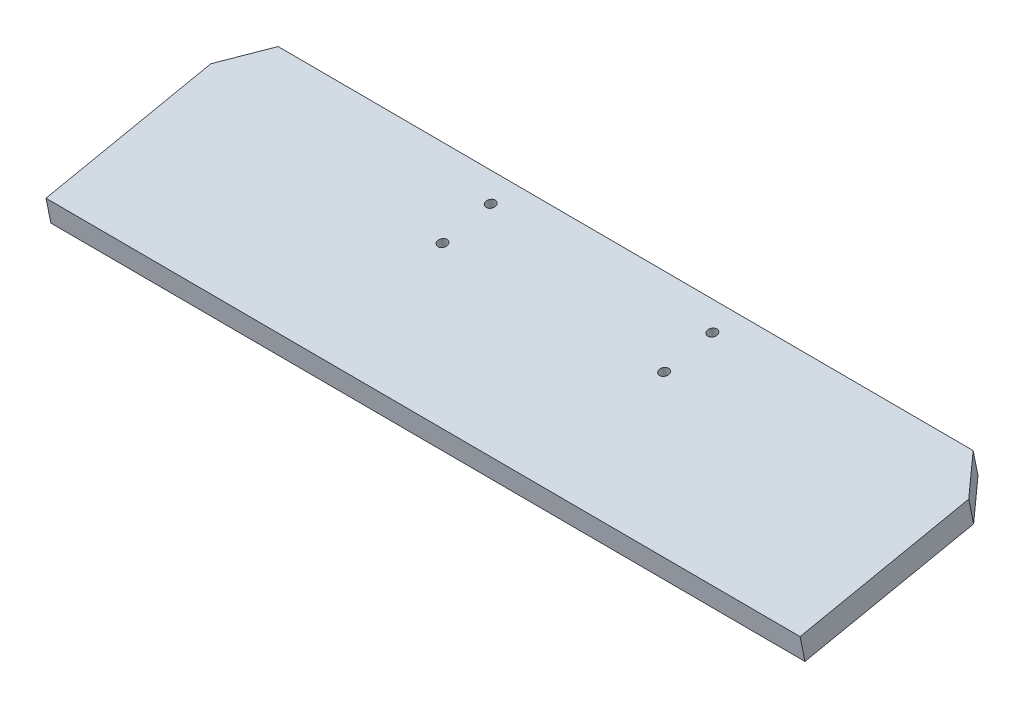
from build123d import *

# Parameters (mm, degrees)
BOSS_EXTRUDE1_DEPTH = 6.35
SKETCH4_R           = 1.190625
CUT_EXTRUDE2_DEPTH  = 398.434844364


with BuildPart() as part:
    # Sketch2 → Boss-Extrude1 (new body)
    with BuildSketch(Plane(origin=(0.683346332, 150.385179261, 31.029771586), x_dir=(-0.9999900978792948, 0.004358374370466655, 0.0008992864979534574), z_dir=(0.004450184643196504, 0.979359636230067, 0.20207646765507412))):
        Polygon((-88.422343932, 329.663853712), (90.808907549, 329.663853712), (97.754590844, 340.296232729), (97.754590844, 383.735739743), (-96.711451797, 383.735739743), (-96.711451797, 339.285739743), align=None)
    extrude(amount=BOSS_EXTRUDE1_DEPTH)

    # Sketch4 → Cut-Extrude2 (cut, through all)
    with BuildSketch(Plane(origin=(0.711605005, 156.604112951, 32.312957155), x_dir=(0.9999900978792948, -0.0043583743704666555, -0.0008992864979534572), z_dir=(0.004450184643196505, 0.9793596362300672, 0.2020764676550741))):
        with Locations((27.381718191, -336.013853712)):
            Circle(SKETCH4_R)
        with Locations((27.381718191, -348.713853712)):
            Circle(SKETCH4_R)
        with Locations((-29.768281809, -348.713853712)):
            Circle(SKETCH4_R)
        with Locations((-29.768281809, -336.013853712)):
            Circle(SKETCH4_R)
    extrude(amount=-CUT_EXTRUDE2_DEPTH, mode=Mode.SUBTRACT)


solid = part.part
